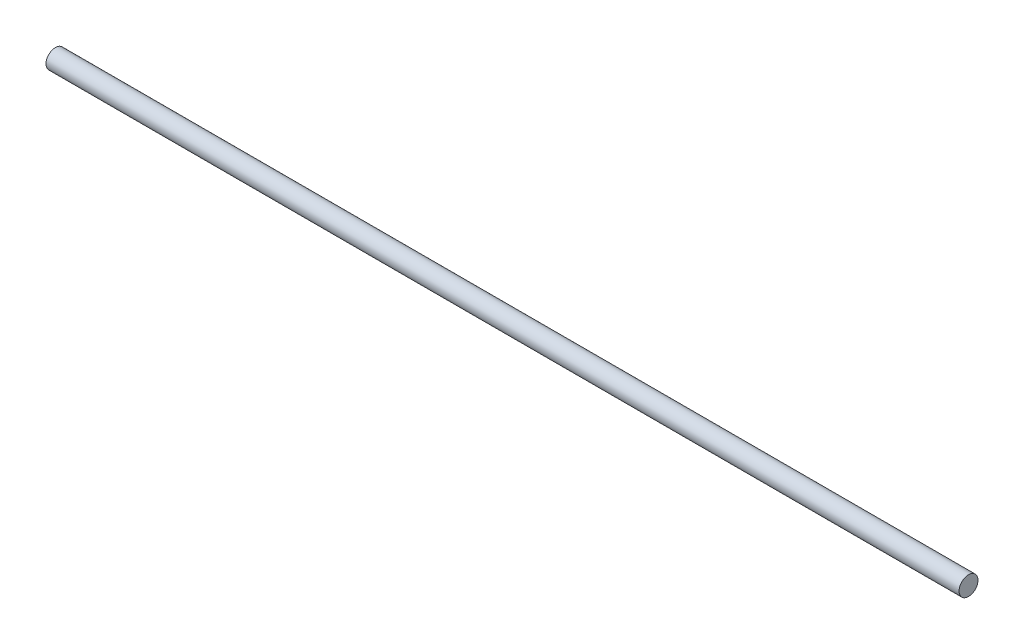
from build123d import *

# Parameters (mm, degrees)
BOSS_EXTRUDE1_DEPTH      = 603.5
BOSS_EXTRUDE1_DEPTH_BACK = 603.5
SKETCH1_R                = 12.5


with BuildPart() as part:
    # Sketch1 → Boss-Extrude1 (new, two sides: drawn at the far end of the back side and taken through both)
    with BuildSketch(Plane(origin=(0, 0, 0), x_dir=(0, 0, -1), z_dir=(1, 0, 0)).offset(-BOSS_EXTRUDE1_DEPTH_BACK)):
        Circle(SKETCH1_R)
    extrude(amount=BOSS_EXTRUDE1_DEPTH + BOSS_EXTRUDE1_DEPTH_BACK)


solid = part.part
